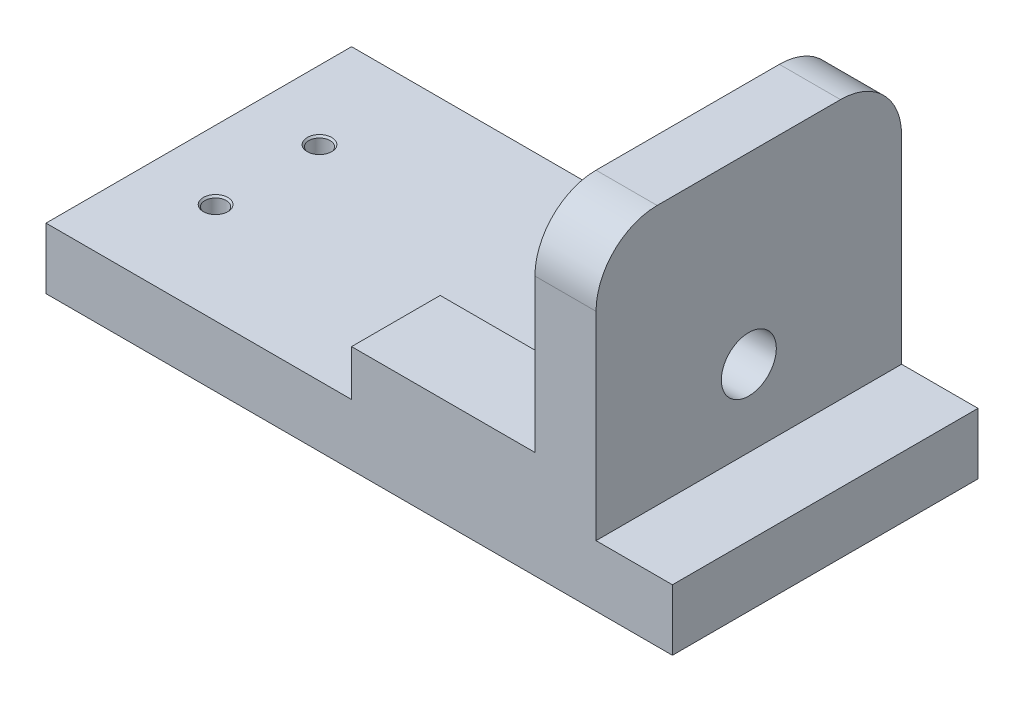
from build123d import *

# Parameters (mm, degrees)
SCHIZZO1_W                          = 205
SCHIZZO1_H                          = 100
ESTRUSIONE_ESTRUSIONE1_DEPTH        = 20
ESTRUSIONE_ESTRUSIONE2_START        = 20
ESTRUSIONE_ESTRUSIONE2_DEPTH        = 85
TAGLIO_ESTRUSIONE1_DEPTH            = 156.020159979
TAGLIO_ESTRUSIONE1_DEPTH_BACK       = 156.020159979
SCHIZZO4_W                          = 60
SCHIZZO4_H                          = 70
TAGLIO_ESTRUSIONE2_START            = 77.5
SCHIZZO6_R                          = 9
TAGLIO_ESTRUSIONE2_DEPTH            = 80
FORO_FILETTATO_M8X1_0_1_D           = 7
FORO_FILETTATO_M8X1_0_1_CSINK_D     = 8.05
FORO_FILETTATO_M8X1_0_1_CSINK_ANGLE = 82


with BuildPart() as part:
    # Schizzo1 → Estrusione-Estrusione1 (new body)
    with BuildSketch(Plane(origin=(0, 0, 0), x_dir=(1, 0, 0), z_dir=(0, 1, 0))):
        Rectangle(SCHIZZO1_W, SCHIZZO1_H)
    extrude(amount=ESTRUSIONE_ESTRUSIONE1_DEPTH)

    # Schizzo2 → Estrusione-Estrusione2 (add)
    with BuildSketch(Plane(origin=(0, 0, 0), x_dir=(1, 0, 0), z_dir=(0, 1, 0)).offset(ESTRUSIONE_ESTRUSIONE2_START)):
        Polygon((77.5, 50), (77.5, -50), (-2.5, -50), (-2.5, -21), (57.5, -21), (57.5, 21), (-2.5, 21), (-2.5, 50), align=None)
    extrude(amount=ESTRUSIONE_ESTRUSIONE2_DEPTH)

    # Schizzo4 → Taglio-Estrusione1 (cut, two sides: drawn at the far end of the back side and taken through both)
    with BuildSketch(Plane.XY.offset(-TAGLIO_ESTRUSIONE1_DEPTH_BACK)):
        with Locations((27.5, 70)):
            Rectangle(SCHIZZO4_W, SCHIZZO4_H)
    extrude(amount=TAGLIO_ESTRUSIONE1_DEPTH + TAGLIO_ESTRUSIONE1_DEPTH_BACK, mode=Mode.SUBTRACT)

    # Schizzo6 → Taglio-Estrusione2 (cut)
    with BuildSketch(Plane(origin=(0, 0, 0), x_dir=(0, 0, -1), z_dir=(1, 0, 0)).offset(TAGLIO_ESTRUSIONE2_START)):
        with Locations((0, 45)):
            Circle(SCHIZZO6_R)
        with BuildLine():
            Line((-50, 85), (-50, 105))
            Line((-50, 105), (-30, 105))
            ThreePointArc((-30, 105), (-44.142135624, 99.142135624), (-50, 85))
        make_face()
        with BuildLine():
            Line((30, 105), (50, 105))
            Line((50, 105), (50, 85))
            ThreePointArc((50, 85), (44.142135624, 99.142135624), (30, 105))
        make_face()
    extrude(amount=-TAGLIO_ESTRUSIONE2_DEPTH, mode=Mode.SUBTRACT)

    # Foro filettato M8x1.0-1 (through all)
    with Locations(Plane(origin=(0, 20, 0), x_dir=(1, 0, 0), z_dir=(0, 1, 0))):
        with Locations((-80, -17), (-80, 17)):
            CounterSinkHole(FORO_FILETTATO_M8X1_0_1_D / 2, FORO_FILETTATO_M8X1_0_1_CSINK_D / 2, counter_sink_angle=FORO_FILETTATO_M8X1_0_1_CSINK_ANGLE)


solid = part.part
